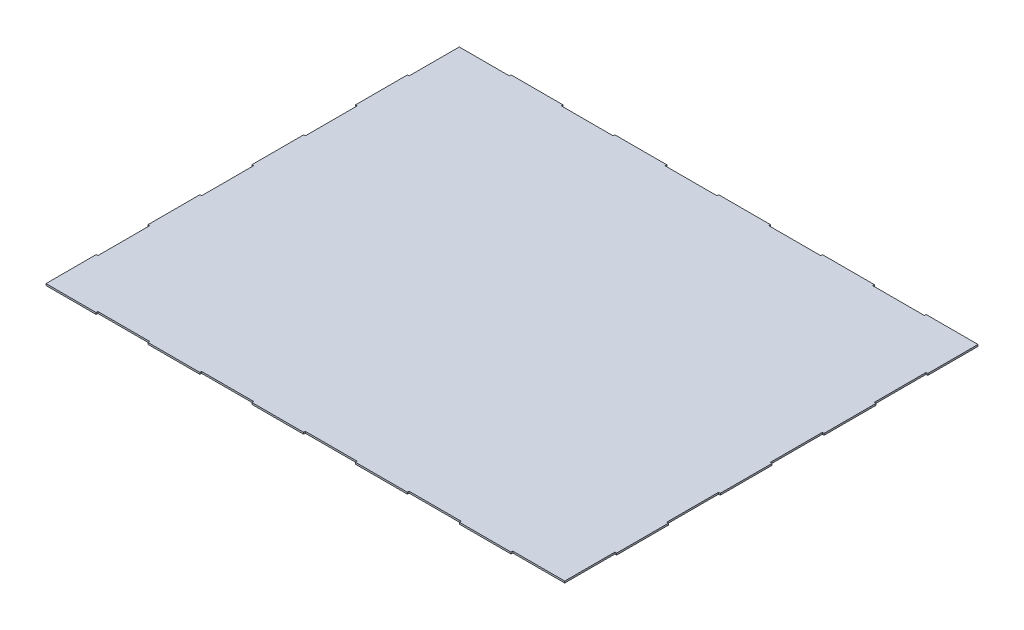
from build123d import *

# Parameters (mm, degrees)
BOSS_EXTRUDE1_DEPTH = 2


with BuildPart() as part:
    # Sketch1 → Boss-Extrude1 (new body)
    with BuildSketch(Plane(origin=(0, 0, 0), x_dir=(1, 0, 0), z_dir=(0, 1, 0))):
        Polygon((0, 0), (58, 0), (58, 2), (118, 2), (118, 0), (178, 0), (178, 2), (238, 2), (238, 0), (298, 0), (298, 2), (358, 2), (358, 0), (418, 0), (418, 2), (478, 2), (478, 0), (538, 0), (538, 2), (598, 2), (598, 60), (600, 60), (600, 120), (598, 120), (598, 180), (600, 180), (600, 240), (598, 240), (598, 300), (600, 300), (600, 360), (598, 360), (598, 420), (600, 420), (600, 478), (540, 478), (540, 476), (480, 476), (480, 478), (420, 478), (420, 476), (360, 476), (360, 478), (300, 478), (300, 476), (240, 476), (240, 478), (180, 478), (180, 476), (120, 476), (120, 478), (60, 478), (60, 476), (2, 476), (2, 418), (0, 418), (0, 358), (2, 358), (2, 298), (0, 298), (0, 238), (2, 238), (2, 178), (0, 178), (0, 118), (2, 118), (2, 58), (0, 58), align=None)
    extrude(amount=BOSS_EXTRUDE1_DEPTH)


solid = part.part
